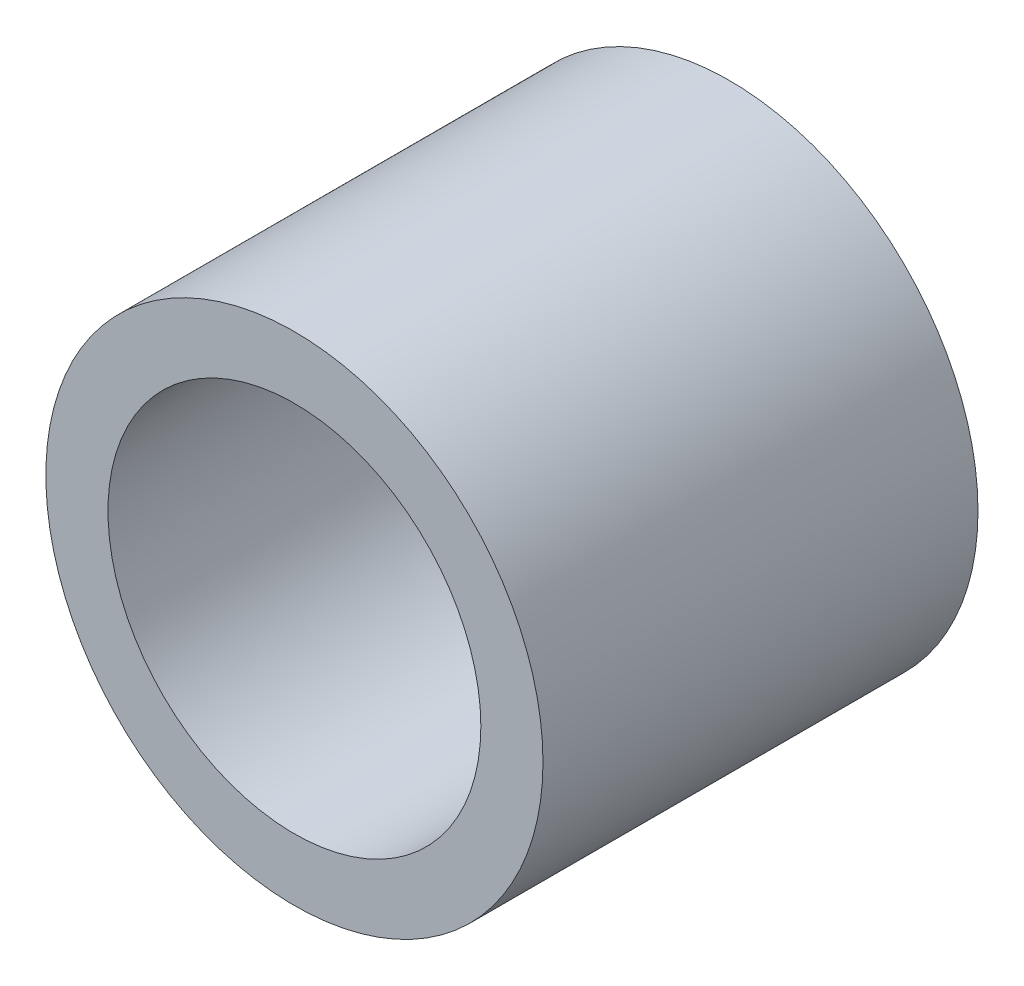
from build123d import *

# Parameters (mm, degrees)
ESQUISSE1_R        = 4
ESQUISSE1_R_2      = 3
BOSS_EXTRU_1_DEPTH = 7


with BuildPart() as part:
    # Esquisse1 → Boss.-Extru.1 (new body)
    with BuildSketch(Plane.XY):
        Circle(ESQUISSE1_R)
        Circle(ESQUISSE1_R_2, mode=Mode.SUBTRACT)
    extrude(amount=BOSS_EXTRU_1_DEPTH)


solid = part.part
